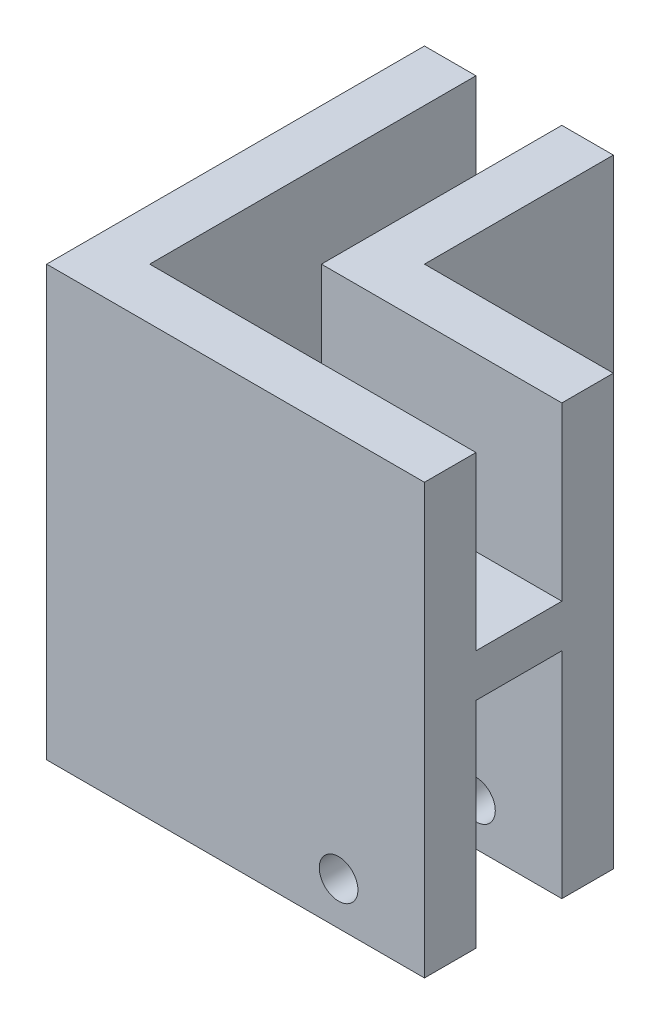
from build123d import *

# Parameters (mm, degrees)
ESTRUSIONE_ESTRUSIONE1_DEPTH = 28
ESTRUSIONE_ESTRUSIONE2_DEPTH = 16
SCHIZZO4_W                   = 16
SCHIZZO4_H                   = 50
ESTRUSIONE_ESTRUSIONE3_DEPTH = 6
ESTRUSIONE_ESTRUSIONE4_DEPTH = 22
FORO_PER_VITE_M4_1_D         = 4.5
FORO_PER_VITE_M4_1_DEPTH     = 30
FORO_PER_VITE_M4_1_TIP       = 1.351936393
FORO_PER_VITE_M4_2_D         = 4.5
FORO_PER_VITE_M4_2_DEPTH     = 30
FORO_PER_VITE_M4_2_TIP       = 1.351936393


with BuildPart() as part:
    # Schizzo2 → Estrusione-Estrusione1 (new body)
    with BuildSketch(Plane.XY):
        Polygon((0, 0), (-10, 0), (-10, -25), (-16, -25), (-16, 25), (-10, 25), (-10, 5), (0, 5), (0, 25), (6, 25), (6, -25), (0, -25), align=None)
    extrude(amount=ESTRUSIONE_ESTRUSIONE1_DEPTH)

    # Schizzo3 → Estrusione-Estrusione2 (add)
    with BuildSketch(Plane(origin=(6, 0, 0), x_dir=(0, 0, -1), z_dir=(1, 0, 0))):
        Polygon((-28, 0), (-38, 0), (-38, -25), (-44, -25), (-44, 25), (-38, 25), (-38, 5), (-28, 5), align=None)
    extrude(amount=-ESTRUSIONE_ESTRUSIONE2_DEPTH)

    # Schizzo4 → Estrusione-Estrusione3 (add)
    with BuildSketch(Plane.ZY.offset(10)):
        with Locations((36, 0)):
            Rectangle(SCHIZZO4_W, SCHIZZO4_H)
    extrude(amount=ESTRUSIONE_ESTRUSIONE3_DEPTH)

    # Schizzo5 → Estrusione-Estrusione4 (add)
    with BuildSketch(Plane(origin=(6, 0, 0), x_dir=(0, 0, -1), z_dir=(1, 0, 0))):
        Polygon((-38, -25), (-44, -25), (-44, 25), (-38, 25), (-38, 5), (-28, 5), (-28, 25), (-22, 25), (-22, -25), (-28, -25), (-28, 0), (-38, 0), align=None)
    extrude(amount=ESTRUSIONE_ESTRUSIONE4_DEPTH)

    # Foro per Vite M4-1
    with Locations(Plane.XY.offset(44)):
        with Locations((18, -20)):
            Hole(FORO_PER_VITE_M4_1_D / 2, depth=FORO_PER_VITE_M4_1_DEPTH)
            with Locations((0, 0, -(FORO_PER_VITE_M4_1_DEPTH + FORO_PER_VITE_M4_1_TIP / 2))):  # 118° drill point
                Cone(0, FORO_PER_VITE_M4_1_D / 2, FORO_PER_VITE_M4_1_TIP, mode=Mode.SUBTRACT)

    # Foro per Vite M4-2
    with Locations(Plane.ZY.offset(16)):
        with Locations((10, -20)):
            Hole(FORO_PER_VITE_M4_2_D / 2, depth=FORO_PER_VITE_M4_2_DEPTH)
            with Locations((0, 0, -(FORO_PER_VITE_M4_2_DEPTH + FORO_PER_VITE_M4_2_TIP / 2))):  # 118° drill point
                Cone(0, FORO_PER_VITE_M4_2_D / 2, FORO_PER_VITE_M4_2_TIP, mode=Mode.SUBTRACT)


solid = part.part
